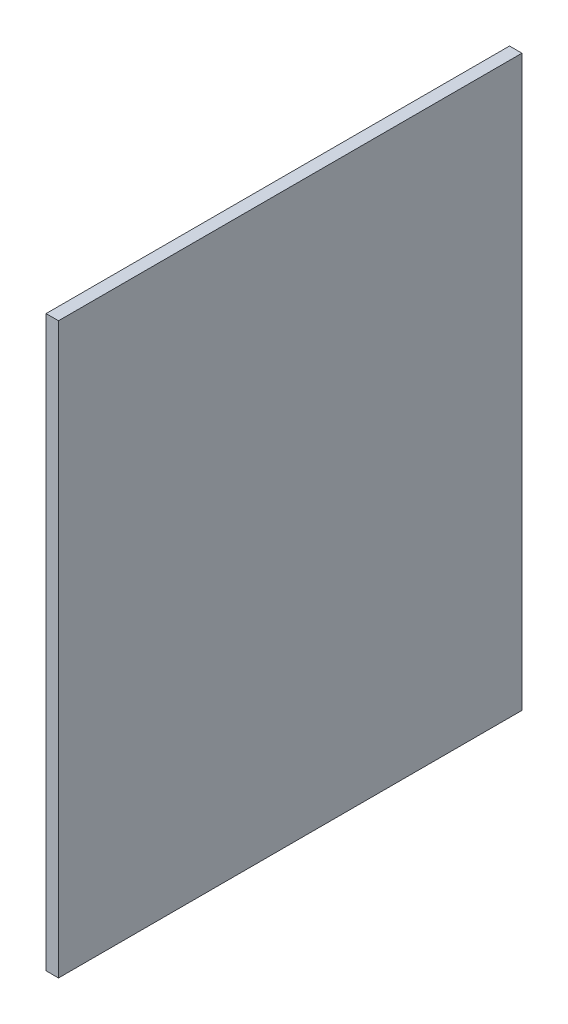
from build123d import *

# Parameters (mm, degrees)
SKETCH2_W           = 819.15
SKETCH2_H           = 1035.05
BOSS_EXTRUDE1_DEPTH = 25.4
SKETCH3_W           = 895.35
SKETCH3_H           = 1111.25
SKETCH3_W_2         = 819.15
SKETCH3_H_2         = 1035.05
BOSS_EXTRUDE2_DEPTH = 25.4
SKETCH4_W           = 946.15
SKETCH4_H           = 1162.05
BOSS_EXTRUDE3_DEPTH = 25.4


with BuildPart() as part:
    # Sketch2 → Boss-Extrude1 (new body)
    with BuildSketch(Plane(origin=(0, 0, 0), x_dir=(0, 0, -1), z_dir=(1, 0, 0))):
        Rectangle(SKETCH2_W, SKETCH2_H)
    extrude(amount=BOSS_EXTRUDE1_DEPTH)

    # Sketch3 → Boss-Extrude2 (add)
    with BuildSketch(Plane(origin=(25.4, 0, 0), x_dir=(0, 0, -1), z_dir=(1, 0, 0))):
        Rectangle(SKETCH3_W, SKETCH3_H)
        Rectangle(SKETCH3_W_2, SKETCH3_H_2, mode=Mode.SUBTRACT)
    extrude(amount=-BOSS_EXTRUDE2_DEPTH)

    # Sketch4 → Boss-Extrude3 (add)
    with BuildSketch(Plane(origin=(25.4, 0, 0), x_dir=(0, 0, -1), z_dir=(1, 0, 0))):
        Rectangle(SKETCH4_W, SKETCH4_H)
    extrude(amount=-BOSS_EXTRUDE3_DEPTH)


solid = part.part
